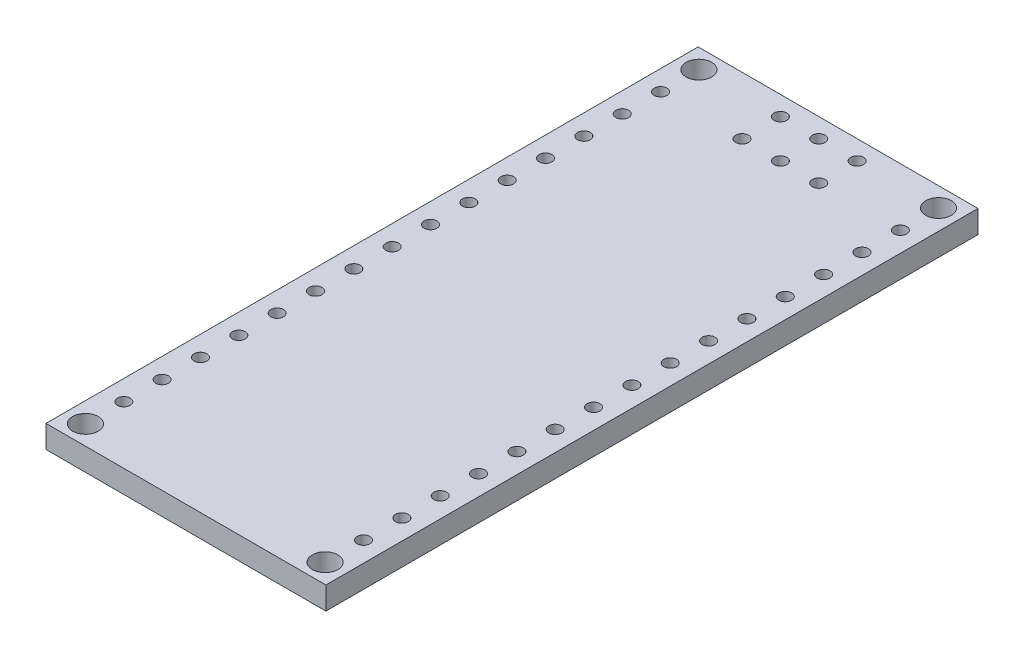
from build123d import *

# Parameters (mm, degrees)
SKETCH1_W           = 18.54
SKETCH1_H           = 43.2
BOSS_EXTRUDE1_DEPTH = 1.5
SKETCH2_R           = 0.846666667
SKETCH2_R_2         = 0.423333333
CUT_EXTRUDE1_DEPTH  = 24.552980703


with BuildPart() as part:
    # Sketch1 → Boss-Extrude1 (new body)
    with BuildSketch(Plane(origin=(0, 0, 0), x_dir=(1, 0, 0), z_dir=(0, 1, 0))):
        Rectangle(SKETCH1_W, SKETCH1_H)
    extrude(amount=BOSS_EXTRUDE1_DEPTH)

    # Sketch2 → Cut-Extrude1 (cut, through all)
    with BuildSketch(Plane(origin=(0, 1.5, 0), x_dir=(1, 0, 0), z_dir=(0, 1, 0))):
        with Locations(Location((7.9375, 20.32, 0), (0, 0, 270))):
            Circle(SKETCH2_R)
        with Locations(Location((7.9375, -20.32, 0), (0, 0, 270))):
            Circle(SKETCH2_R)
        with Locations(Location((-7.9375, -20.32, 0), (0, 0, 270))):
            Circle(SKETCH2_R)
        with Locations(Location((-7.9375, 20.32, 0), (0, 0, 270))):
            Circle(SKETCH2_R)
        with Locations(Location((-7.9375, -17.78, 0), (0, 0, 270))):
            Circle(SKETCH2_R_2)
        with Locations(Location((-7.9375, -15.24, 0), (0, 0, 270))):
            Circle(SKETCH2_R_2)
        with Locations(Location((-7.9375, -12.7, 0), (0, 0, 270))):
            Circle(SKETCH2_R_2)
        with Locations(Location((-7.9375, -10.16, 0), (0, 0, 270))):
            Circle(SKETCH2_R_2)
        with Locations(Location((-7.9375, -7.62, 0), (0, 0, 270))):
            Circle(SKETCH2_R_2)
        with Locations(Location((-7.9375, -5.08, 0), (0, 0, 270))):
            Circle(SKETCH2_R_2)
        with Locations(Location((-7.9375, -2.54, 0), (0, 0, 270))):
            Circle(SKETCH2_R_2)
        with Locations(Location((-7.9375, 0, 0), (0, 0, 270))):
            Circle(SKETCH2_R_2)
        with Locations(Location((-7.9375, 2.54, 0), (0, 0, 270))):
            Circle(SKETCH2_R_2)
        with Locations(Location((-7.9375, 5.08, 0), (0, 0, 270))):
            Circle(SKETCH2_R_2)
        with Locations(Location((-7.9375, 7.62, 0), (0, 0, 270))):
            Circle(SKETCH2_R_2)
        with Locations(Location((-7.9375, 10.16, 0), (0, 0, 270))):
            Circle(SKETCH2_R_2)
        with Locations(Location((-7.9375, 12.7, 0), (0, 0, 270))):
            Circle(SKETCH2_R_2)
        with Locations(Location((-7.9375, 15.24, 0), (0, 0, 270))):
            Circle(SKETCH2_R_2)
        with Locations(Location((-7.9375, 17.78, 0), (0, 0, 270))):
            Circle(SKETCH2_R_2)
        with Locations(Location((7.9425, -15.24, 0), (0, 0, 270))):
            Circle(SKETCH2_R_2)
        with Locations(Location((7.9425, -12.7, 0), (0, 0, 270))):
            Circle(SKETCH2_R_2)
        with Locations(Location((7.9425, -10.16, 0), (0, 0, 270))):
            Circle(SKETCH2_R_2)
        with Locations(Location((7.9425, -7.62, 0), (0, 0, 270))):
            Circle(SKETCH2_R_2)
        with Locations(Location((7.9425, -5.08, 0), (0, 0, 270))):
            Circle(SKETCH2_R_2)
        with Locations(Location((7.9425, -2.54, 0), (0, 0, 270))):
            Circle(SKETCH2_R_2)
        with Locations(Location((7.9425, 0, 0), (0, 0, 270))):
            Circle(SKETCH2_R_2)
        with Locations(Location((7.9425, 2.54, 0), (0, 0, 270))):
            Circle(SKETCH2_R_2)
        with Locations(Location((7.9425, 5.08, 0), (0, 0, 270))):
            Circle(SKETCH2_R_2)
        with Locations(Location((7.9425, 7.62, 0), (0, 0, 270))):
            Circle(SKETCH2_R_2)
        with Locations(Location((7.9425, 10.16, 0), (0, 0, 270))):
            Circle(SKETCH2_R_2)
        with Locations(Location((7.9425, 12.7, 0), (0, 0, 270))):
            Circle(SKETCH2_R_2)
        with Locations(Location((7.9425, 15.24, 0), (0, 0, 270))):
            Circle(SKETCH2_R_2)
        with Locations(Location((7.9425, 17.78, 0), (0, 0, 270))):
            Circle(SKETCH2_R_2)
        with Locations(Location((7.9425, -17.78, 0), (0, 0, 270))):
            Circle(SKETCH2_R_2)
        with Locations(Location((0, 20.32, 0), (0, 0, 270))):
            Circle(SKETCH2_R_2)
        with Locations(Location((-2.54, 20.32, 0), (0, 0, 270))):
            Circle(SKETCH2_R_2)
        with Locations(Location((2.54, 20.32, 0), (0, 0, 270))):
            Circle(SKETCH2_R_2)
        with Locations(Location((-2.54, 17.78, 0), (0, 0, 270))):
            Circle(SKETCH2_R_2)
        with Locations(Location((0, 17.78, 0), (0, 0, 270))):
            Circle(SKETCH2_R_2)
        with Locations(Location((2.54, 17.78, 0), (0, 0, 270))):
            Circle(SKETCH2_R_2)
    extrude(amount=-CUT_EXTRUDE1_DEPTH, mode=Mode.SUBTRACT)


solid = part.part
